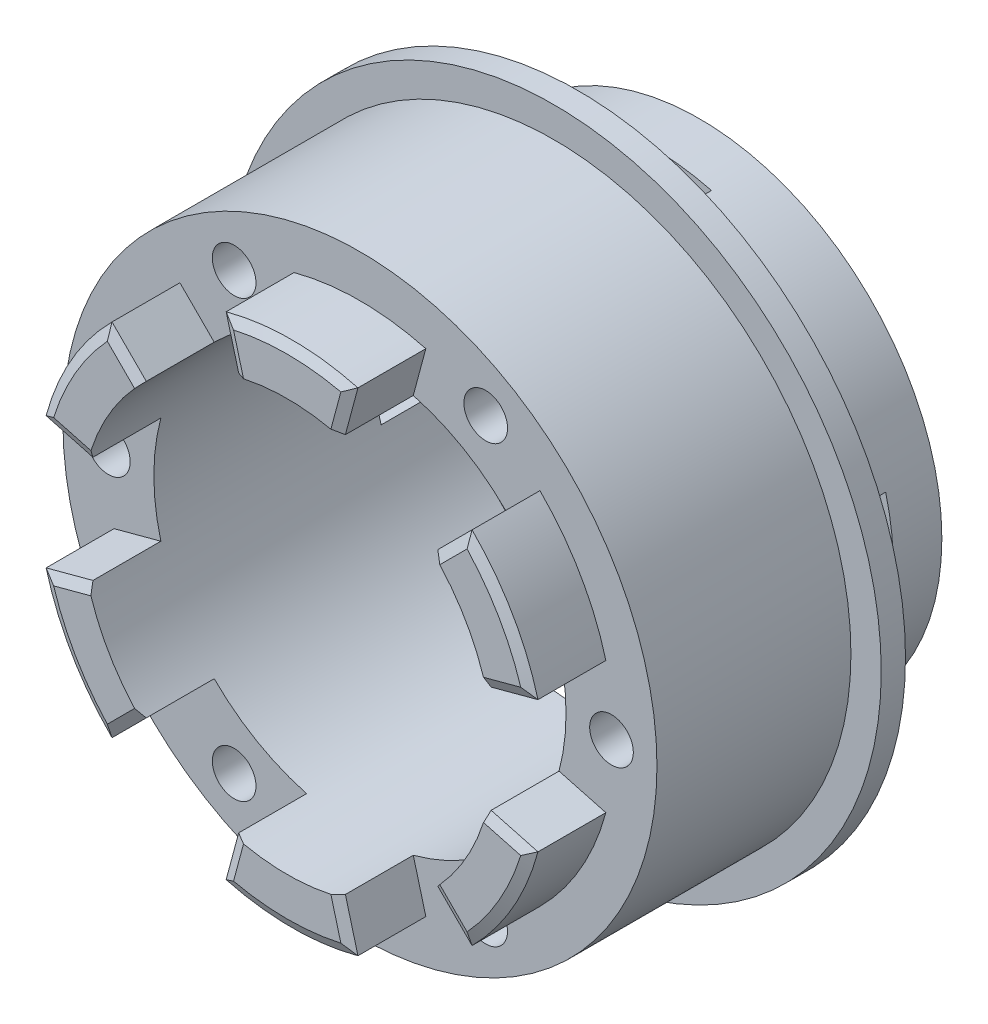
from build123d import *
from OCP.BRepFilletAPI import BRepFilletAPI_MakeChamfer

# Parameters (mm, degrees)
SKETCH_1_R               = 10
EXTRUDE_1_DEPTH          = 2
SKETCH_2_R               = 10
SKETCH_2_R_2             = 8.5
EXTRUDE_2_DEPTH          = 3
SKETCH_4_R               = 13.5
SKETCH_4_R_2             = 8.5
EXTRUDE_3_DEPTH          = 1
SKETCH_5_R               = 12.25
SKETCH_5_R_2             = 8.5
EXTRUDE_4_DEPTH          = 8
SKETCH_6_R               = 0.9
CUT_EXTRUDE_1_DEPTH      = 8
SKETCH_7_R               = 3
SKETCH_7_R_2             = 1.15
CUT_EXTRUDE_2_DEPTH      = 24.674881204
CUT_EXTRUDE_3_DEPTH      = 24.674881204
CUT_EXTRUDE_3_DEPTH_BACK = 24.674881204
SKETCH_8_W               = 5
SKETCH_8_H               = 3
CUT_EXTRUDE_4_DEPTH      = 24.674881204
CUT_EXTRUDE_4_DEPTH_BACK = 24.674881204
SKETCH_9_W               = 3
SKETCH_9_H               = 5
EXTRUDE_5_DEPTH          = 3
CHAMFER_1_SIZE           = 0.2
CHAMFER_1_SIZE2          = 0.410060768


with BuildPart() as part:
    # 스케치1 → 보스-돌출1 (new body)
    with BuildSketch(Plane.XY):
        Circle(SKETCH_1_R)
    extrude(amount=EXTRUDE_1_DEPTH)

    # 스케치2 → 보스-돌출2 (add)
    with BuildSketch(Plane.XY.offset(2)):
        Circle(SKETCH_2_R)
        Circle(SKETCH_2_R_2, mode=Mode.SUBTRACT)
    extrude(amount=EXTRUDE_2_DEPTH)

    # 스케치4 → 보스-돌출3 (add)
    with BuildSketch(Plane.XY.offset(5)):
        Circle(SKETCH_4_R)
        Circle(SKETCH_4_R_2, mode=Mode.SUBTRACT)
    extrude(amount=EXTRUDE_3_DEPTH)

    # 스케치5 → 보스-돌출4 (add)
    with BuildSketch(Plane.XY.offset(6)):
        Circle(SKETCH_5_R)
        Circle(SKETCH_5_R_2, mode=Mode.SUBTRACT)
    extrude(amount=EXTRUDE_4_DEPTH)

    # 스케치6 → 컷-돌출1 (cut)
    with BuildSketch(Plane.XY.offset(14)):
        with Locations((10.375, 0)):
            Circle(SKETCH_6_R)
        with Locations((5.1875, -8.985013564)):
            Circle(SKETCH_6_R)
        with Locations((-5.1875, -8.985013564)):
            Circle(SKETCH_6_R)
        with Locations((-10.375, 0)):
            Circle(SKETCH_6_R)
        with Locations((-5.1875, 8.985013564)):
            Circle(SKETCH_6_R)
        with Locations((5.1875, 8.985013564)):
            Circle(SKETCH_6_R)
    extrude(amount=-CUT_EXTRUDE_1_DEPTH, mode=Mode.SUBTRACT)

    # 스케치7 → 컷-돌출2 (cut, through all)
    with BuildSketch(Plane(origin=(0, 0, 0), x_dir=(-1, 0, 0), z_dir=(0, 0, -1))):
        Circle(SKETCH_7_R)
        with Locations((-7, 0)):
            Circle(SKETCH_7_R_2)
        with Locations((7, 0)):
            Circle(SKETCH_7_R_2)
        with Locations((0, 7)):
            Circle(SKETCH_7_R_2)
        with Locations((0, -7)):
            Circle(SKETCH_7_R_2)
    extrude(amount=-CUT_EXTRUDE_2_DEPTH, mode=Mode.SUBTRACT)

    # 스케치8 → 컷-돌출3 (cut, two sides: drawn at the far end of the back side and taken through both)
    with BuildSketch(Plane(origin=(0, 0, 0), x_dir=(1, 0, 0), z_dir=(0, 1, 0)).offset(-CUT_EXTRUDE_3_DEPTH_BACK)):
        with Locations((0, -3.5)):
            Rectangle(SKETCH_8_W, SKETCH_8_H)
    extrude(amount=CUT_EXTRUDE_3_DEPTH + CUT_EXTRUDE_3_DEPTH_BACK, mode=Mode.SUBTRACT)

    # 스케치9 → 컷-돌출4 (cut, two sides: drawn at the far end of the back side and taken through both)
    with BuildSketch(Plane(origin=(0, 0, 0), x_dir=(0, 0, -1), z_dir=(1, 0, 0)).offset(-CUT_EXTRUDE_4_DEPTH_BACK)):
        with Locations((-3.5, 0)):
            Rectangle(SKETCH_9_W, SKETCH_9_H)
    extrude(amount=CUT_EXTRUDE_4_DEPTH + CUT_EXTRUDE_4_DEPTH_BACK, mode=Mode.SUBTRACT)

    # 스케치10 → 보스-돌출5 (add)
    with BuildSketch(Plane.XY.offset(14)):
        with BuildLine():
            Line((2.199961883, 8.210369523), (2.717599974, 10.142221176))
            ThreePointArc((2.717599974, 10.142221176), (0, 10.5), (-2.717599974, 10.142221176))
            Line((-2.717599974, 10.142221176), (-2.199961883, 8.210369523))
            ThreePointArc((-2.199961883, 8.210369523), (0, 8.5), (2.199961883, 8.210369523))
        make_face()
        with BuildLine():
            Line((6.01040764, 6.01040764), (7.424621202, 7.424621202))
            ThreePointArc((7.424621202, 7.424621202), (9.09326674, 5.25), (10.142221176, 2.717599974))
            Line((10.142221176, 2.717599974), (8.210369523, 2.199961883))
            ThreePointArc((8.210369523, 2.199961883), (7.361215932, 4.25), (6.01040764, 6.01040764))
        make_face()
        with BuildLine():
            Line((8.210369523, -2.199961883), (10.142221176, -2.717599974))
            ThreePointArc((10.142221176, -2.717599974), (9.09326674, -5.25), (7.424621202, -7.424621202))
            Line((7.424621202, -7.424621202), (6.01040764, -6.01040764))
            ThreePointArc((6.01040764, -6.01040764), (7.361215932, -4.25), (8.210369523, -2.199961883))
        make_face()
        with BuildLine():
            Line((2.199961883, -8.210369523), (2.717599974, -10.142221176))
            ThreePointArc((2.717599974, -10.142221176), (0, -10.5), (-2.717599974, -10.142221176))
            Line((-2.717599974, -10.142221176), (-2.199961883, -8.210369523))
            ThreePointArc((-2.199961883, -8.210369523), (0, -8.5), (2.199961883, -8.210369523))
        make_face()
        with BuildLine():
            Line((-6.01040764, -6.01040764), (-7.424621202, -7.424621202))
            ThreePointArc((-7.424621202, -7.424621202), (-9.09326674, -5.25), (-10.142221176, -2.717599974))
            Line((-10.142221176, -2.717599974), (-8.210369523, -2.199961883))
            ThreePointArc((-8.210369523, -2.199961883), (-7.361215932, -4.25), (-6.01040764, -6.01040764))
        make_face()
        with BuildLine():
            Line((-8.210369523, 2.199961883), (-10.142221176, 2.717599974))
            ThreePointArc((-10.142221176, 2.717599974), (-9.09326674, 5.25), (-7.424621202, 7.424621202))
            Line((-7.424621202, 7.424621202), (-6.01040764, 6.01040764))
            ThreePointArc((-6.01040764, 6.01040764), (-7.361215932, 4.25), (-8.210369523, 2.199961883))
        make_face()
    extrude(amount=EXTRUDE_5_DEPTH)

    # 모따기1: one chamfer whose edges measure the first distance from different faces: ONE call of the kernel's chamfer builder (chamfer() names one face for all edges)
    chamfer_1_edges_1 = [part.edges().sort_by_distance(p)[0] for p in [
        (-6.717514421, 6.717514421, 17),
    ]]
    chamfer_1_side_1 = [part.faces().sort_by_distance(p)[0] for p in [
        (-6.717514421, 6.717514421, 15.5),
    ]]
    chamfer_1_edges_2 = [part.edges().sort_by_distance(p)[0] for p in [
        (-9.09326674, 5.25, 17),
    ]]
    chamfer_1_side_2 = [part.faces().sort_by_distance(p)[0] for p in [
        (-9.09326674, 5.25, 15.5),
    ]]
    chamfer_1_edges_3 = [part.edges().sort_by_distance(p)[0] for p in [
        (-9.17629535, 2.458780928, 17),
    ]]
    chamfer_1_side_3 = [part.faces().sort_by_distance(p)[0] for p in [
        (-9.17629535, 2.458780928, 15.5),
    ]]
    chamfer_1_edges_4 = [part.edges().sort_by_distance(p)[0] for p in [
        (-9.17629535, -2.458780928, 17),
    ]]
    chamfer_1_side_4 = [part.faces().sort_by_distance(p)[0] for p in [
        (-9.17629535, -2.458780928, 15.5),
    ]]
    chamfer_1_edges_5 = [part.edges().sort_by_distance(p)[0] for p in [
        (-9.09326674, -5.25, 17),
    ]]
    chamfer_1_side_5 = [part.faces().sort_by_distance(p)[0] for p in [
        (-9.09326674, -5.25, 15.5),
    ]]
    chamfer_1_edges_6 = [part.edges().sort_by_distance(p)[0] for p in [
        (-6.717514421, -6.717514421, 17),
    ]]
    chamfer_1_side_6 = [part.faces().sort_by_distance(p)[0] for p in [
        (-6.717514421, -6.717514421, 15.5),
    ]]
    chamfer_1_edges_7 = [part.edges().sort_by_distance(p)[0] for p in [
        (0, 10.5, 17),
    ]]
    chamfer_1_side_7 = [part.faces().sort_by_distance(p)[0] for p in [
        (0, 10.5, 15.5),
    ]]
    chamfer_1_edges_8 = [part.edges().sort_by_distance(p)[0] for p in [
        (-2.458780928, 9.17629535, 17),
    ]]
    chamfer_1_side_8 = [part.faces().sort_by_distance(p)[0] for p in [
        (-2.458780928, 9.17629535, 15.5),
    ]]
    chamfer_1_edges_9 = [part.edges().sort_by_distance(p)[0] for p in [
        (2.458780928, 9.17629535, 17),
    ]]
    chamfer_1_side_9 = [part.faces().sort_by_distance(p)[0] for p in [
        (2.458780928, 9.17629535, 15.5),
    ]]
    chamfer_1_edges_10 = [part.edges().sort_by_distance(p)[0] for p in [
        (-2.458780928, -9.17629535, 17),
    ]]
    chamfer_1_side_10 = [part.faces().sort_by_distance(p)[0] for p in [
        (-2.458780928, -9.17629535, 15.5),
    ]]
    chamfer_1_edges_11 = [part.edges().sort_by_distance(p)[0] for p in [
        (0, -10.5, 17),
    ]]
    chamfer_1_side_11 = [part.faces().sort_by_distance(p)[0] for p in [
        (0, -10.5, 15.5),
    ]]
    chamfer_1_edges_12 = [part.edges().sort_by_distance(p)[0] for p in [
        (2.458780928, -9.17629535, 17),
    ]]
    chamfer_1_side_12 = [part.faces().sort_by_distance(p)[0] for p in [
        (2.458780928, -9.17629535, 15.5),
    ]]
    chamfer_1_edges_13 = [part.edges().sort_by_distance(p)[0] for p in [
        (9.09326674, 5.25, 17),
    ]]
    chamfer_1_side_13 = [part.faces().sort_by_distance(p)[0] for p in [
        (9.09326674, 5.25, 15.5),
    ]]
    chamfer_1_edges_14 = [part.edges().sort_by_distance(p)[0] for p in [
        (6.717514421, 6.717514421, 17),
    ]]
    chamfer_1_side_14 = [part.faces().sort_by_distance(p)[0] for p in [
        (6.717514421, 6.717514421, 15.5),
    ]]
    chamfer_1_edges_15 = [part.edges().sort_by_distance(p)[0] for p in [
        (9.17629535, 2.458780928, 17),
    ]]
    chamfer_1_side_15 = [part.faces().sort_by_distance(p)[0] for p in [
        (9.17629535, 2.458780928, 15.5),
    ]]
    chamfer_1_edges_16 = [part.edges().sort_by_distance(p)[0] for p in [
        (6.717514421, -6.717514421, 17),
    ]]
    chamfer_1_side_16 = [part.faces().sort_by_distance(p)[0] for p in [
        (6.717514421, -6.717514421, 15.5),
    ]]
    chamfer_1_edges_17 = [part.edges().sort_by_distance(p)[0] for p in [
        (9.09326674, -5.25, 17),
    ]]
    chamfer_1_side_17 = [part.faces().sort_by_distance(p)[0] for p in [
        (9.09326674, -5.25, 15.5),
    ]]
    chamfer_1_edges_18 = [part.edges().sort_by_distance(p)[0] for p in [
        (9.17629535, -2.458780928, 17),
    ]]
    chamfer_1_side_18 = [part.faces().sort_by_distance(p)[0] for p in [
        (9.17629535, -2.458780928, 15.5),
    ]]
    chamfer_1 = BRepFilletAPI_MakeChamfer(part.part.solid().wrapped)
    for e in chamfer_1_edges_1:
        chamfer_1.Add(CHAMFER_1_SIZE, CHAMFER_1_SIZE2, e.wrapped, chamfer_1_side_1[0].wrapped)  # the first distance lies on this face
    for e in chamfer_1_edges_2:
        chamfer_1.Add(CHAMFER_1_SIZE, CHAMFER_1_SIZE2, e.wrapped, chamfer_1_side_2[0].wrapped)  # the first distance lies on this face
    for e in chamfer_1_edges_3:
        chamfer_1.Add(CHAMFER_1_SIZE, CHAMFER_1_SIZE2, e.wrapped, chamfer_1_side_3[0].wrapped)  # the first distance lies on this face
    for e in chamfer_1_edges_4:
        chamfer_1.Add(CHAMFER_1_SIZE, CHAMFER_1_SIZE2, e.wrapped, chamfer_1_side_4[0].wrapped)  # the first distance lies on this face
    for e in chamfer_1_edges_5:
        chamfer_1.Add(CHAMFER_1_SIZE, CHAMFER_1_SIZE2, e.wrapped, chamfer_1_side_5[0].wrapped)  # the first distance lies on this face
    for e in chamfer_1_edges_6:
        chamfer_1.Add(CHAMFER_1_SIZE, CHAMFER_1_SIZE2, e.wrapped, chamfer_1_side_6[0].wrapped)  # the first distance lies on this face
    for e in chamfer_1_edges_7:
        chamfer_1.Add(CHAMFER_1_SIZE, CHAMFER_1_SIZE2, e.wrapped, chamfer_1_side_7[0].wrapped)  # the first distance lies on this face
    for e in chamfer_1_edges_8:
        chamfer_1.Add(CHAMFER_1_SIZE, CHAMFER_1_SIZE2, e.wrapped, chamfer_1_side_8[0].wrapped)  # the first distance lies on this face
    for e in chamfer_1_edges_9:
        chamfer_1.Add(CHAMFER_1_SIZE, CHAMFER_1_SIZE2, e.wrapped, chamfer_1_side_9[0].wrapped)  # the first distance lies on this face
    for e in chamfer_1_edges_10:
        chamfer_1.Add(CHAMFER_1_SIZE, CHAMFER_1_SIZE2, e.wrapped, chamfer_1_side_10[0].wrapped)  # the first distance lies on this face
    for e in chamfer_1_edges_11:
        chamfer_1.Add(CHAMFER_1_SIZE, CHAMFER_1_SIZE2, e.wrapped, chamfer_1_side_11[0].wrapped)  # the first distance lies on this face
    for e in chamfer_1_edges_12:
        chamfer_1.Add(CHAMFER_1_SIZE, CHAMFER_1_SIZE2, e.wrapped, chamfer_1_side_12[0].wrapped)  # the first distance lies on this face
    for e in chamfer_1_edges_13:
        chamfer_1.Add(CHAMFER_1_SIZE, CHAMFER_1_SIZE2, e.wrapped, chamfer_1_side_13[0].wrapped)  # the first distance lies on this face
    for e in chamfer_1_edges_14:
        chamfer_1.Add(CHAMFER_1_SIZE, CHAMFER_1_SIZE2, e.wrapped, chamfer_1_side_14[0].wrapped)  # the first distance lies on this face
    for e in chamfer_1_edges_15:
        chamfer_1.Add(CHAMFER_1_SIZE, CHAMFER_1_SIZE2, e.wrapped, chamfer_1_side_15[0].wrapped)  # the first distance lies on this face
    for e in chamfer_1_edges_16:
        chamfer_1.Add(CHAMFER_1_SIZE, CHAMFER_1_SIZE2, e.wrapped, chamfer_1_side_16[0].wrapped)  # the first distance lies on this face
    for e in chamfer_1_edges_17:
        chamfer_1.Add(CHAMFER_1_SIZE, CHAMFER_1_SIZE2, e.wrapped, chamfer_1_side_17[0].wrapped)  # the first distance lies on this face
    for e in chamfer_1_edges_18:
        chamfer_1.Add(CHAMFER_1_SIZE, CHAMFER_1_SIZE2, e.wrapped, chamfer_1_side_18[0].wrapped)  # the first distance lies on this face
    add(Compound.cast(chamfer_1.Shape()), mode=Mode.REPLACE)


solid = part.part
